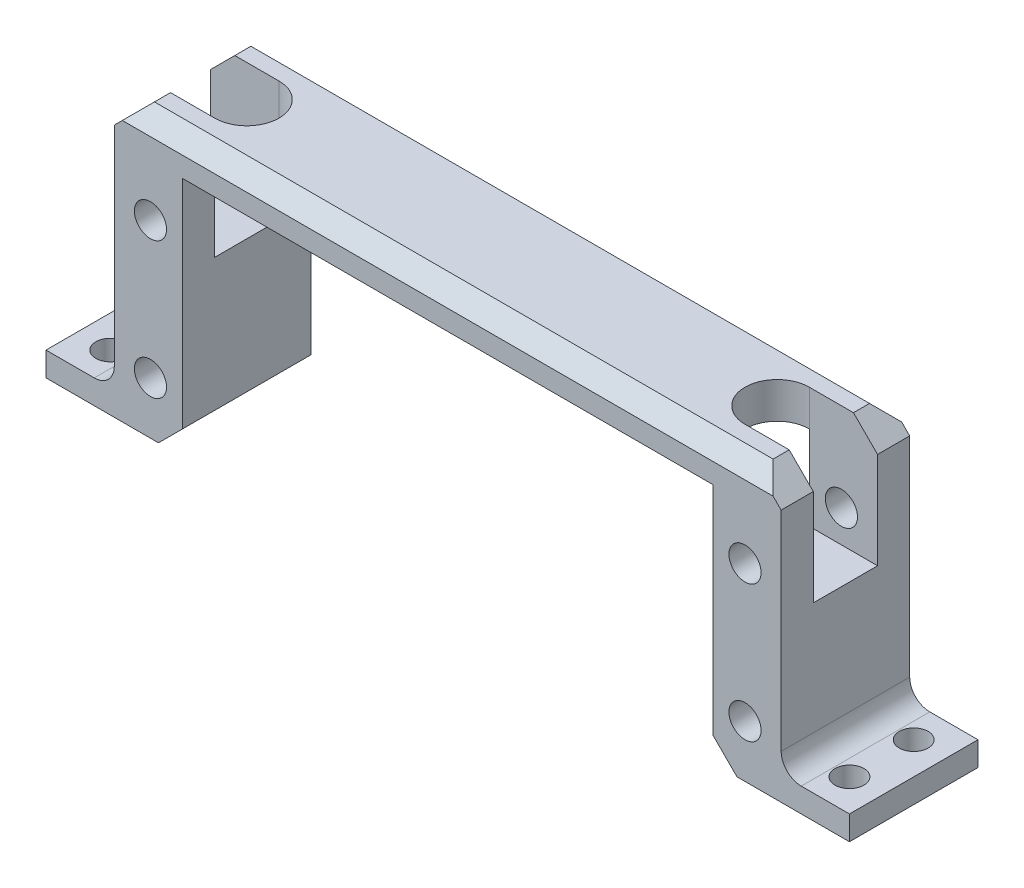
from build123d import *

# Parameters (mm, degrees)
BOSS_EXTRUDE1_DEPTH = 8
CHAMFER5_SIZE       = 3
FILLET1_R           = 2.5
SKETCH2_R           = 2
CUT_EXTRUDE1_DEPTH  = 63.819184968
SKETCH3_R           = 1.8
CUT_EXTRUDE2_DEPTH  = 60.634302209
SKETCH5_W           = 8.5
SKETCH5_H           = 8
CUT_EXTRUDE3_DEPTH  = 15
CUT_EXTRUDE5_DEPTH  = 15
CHAMFER6_SIZE       = 2


with BuildPart() as part:
    # Sketch1 → Boss-Extrude1 (new, symmetric)
    with BuildSketch(Plane.XY):
        Polygon((-50, 0), (-33, 0), (-33, 30), (33, 30), (33, 0), (50, 0), (50, 3), (41.5, 3), (41.5, 34.5), (-41.5, 34.5), (-41.5, 3), (-50, 3), align=None)
    extrude(amount=BOSS_EXTRUDE1_DEPTH, both=True)

    # Chamfer5
    chamfer5_edges = [part.edges().sort_by_distance(p)[0] for p in [
        (-41.5, 34.5, 0),
        (41.5, 34.5, 0),
        (33, 0, 0),
        (-33, 0, 0),
    ]]
    chamfer(chamfer5_edges, length=CHAMFER5_SIZE)

    # Fillet1
    fillet1_edges = [part.edges().sort_by_distance(p)[0] for p in [
        (-41.5, 3, 0),
        (41.5, 3, 0),
    ]]
    fillet(fillet1_edges, radius=FILLET1_R)

    # Sketch2 → Cut-Extrude1 (cut, through all)
    with BuildSketch(Plane.XY.offset(8)):
        with Locations((37, 23.5)):
            Circle(SKETCH2_R)
        with Locations((37, 6.5)):
            Circle(SKETCH2_R)
    cut_extrude1 = extrude(amount=-CUT_EXTRUDE1_DEPTH, mode=Mode.SUBTRACT)

    # Mirror1: Cut-Extrude1 across plane
    add(cut_extrude1.mirror(Plane(origin=(0, 0, 0), x_dir=(0, 0, 1), z_dir=(1, 0, 0))), mode=Mode.SUBTRACT)

    # Sketch3 → Cut-Extrude2 (cut, through all)
    with BuildSketch(Plane(origin=(0, 3, 0), x_dir=(1, 0, 0), z_dir=(0, 1, 0))):
        with Locations(Location((46, 4, 0), (0, 0, 270))):
            Circle(SKETCH3_R)
        with Locations(Location((46, -4, 0), (0, 0, 270))):
            Circle(SKETCH3_R)
        with Locations(Location((-46, 4, 0), (0, 0, 270))):
            Circle(SKETCH3_R)
        with Locations(Location((-46, -4, 0), (0, 0, 270))):
            Circle(SKETCH3_R)
    extrude(amount=-CUT_EXTRUDE2_DEPTH, mode=Mode.SUBTRACT)

    # Sketch5 → Cut-Extrude3 (cut)
    with BuildSketch(Plane(origin=(0, 34.5, 0), x_dir=(1, 0, 0), z_dir=(0, 1, 0))):
        with Locations((37.25, 0)):
            Rectangle(SKETCH5_W, SKETCH5_H)
        with Locations((-37.25, 0)):
            Rectangle(SKETCH5_W, SKETCH5_H)
    extrude(amount=-CUT_EXTRUDE3_DEPTH, mode=Mode.SUBTRACT)

    # Sketch7 → Cut-Extrude5 (cut)
    with BuildSketch(Plane(origin=(0, 34.5, 0), x_dir=(1, 0, 0), z_dir=(0, 1, 0))):
        with BuildLine():
            Line((33, 4), (33, -4))
            ThreePointArc((33, -4), (29, 0), (33, 4))
        make_face()
        with BuildLine():
            Line((-33, 4), (-33, -4))
            ThreePointArc((-33, -4), (-29, 0), (-33, 4))
        make_face()
    extrude(amount=-CUT_EXTRUDE5_DEPTH, mode=Mode.SUBTRACT)

    # Chamfer6
    chamfer6_edges = [part.edges().sort_by_distance(p)[0] for p in [
        (0, 34.5, -8),
        (0, 34.5, 8),
    ]]
    chamfer(chamfer6_edges, length=CHAMFER6_SIZE)


solid = part.part
